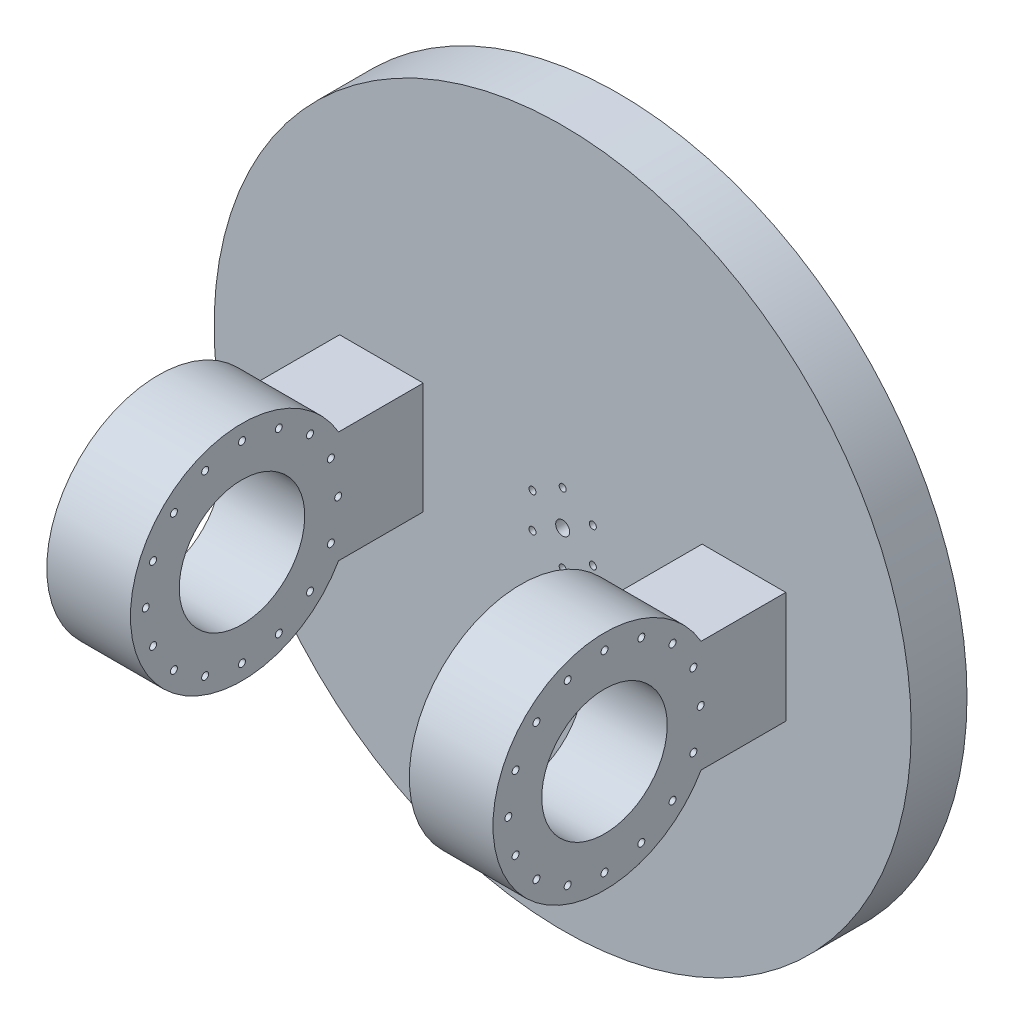
from build123d import *

# Parameters (mm, degrees)
SKETCH_1_R               = 16
EXTRUDE_1_DEPTH          = 10
SKETCH_2_R               = 1.25
EXTRUDE_2_DEPTH          = 10.2
SKETCH_3_R               = 125
EXTRUDE_3_DEPTH          = 20
SKETCH_4_W               = 30
SKETCH_4_H               = 40
EXTRUDE_4_DEPTH          = 41.07
SKETCH_7_R               = 4.1
CUT_EXTRUDE_1_DEPTH      = 4
SKETCH_16_R              = 40
EXTRUDE_10_DEPTH         = 30
EXTRUDE_START            = -30
EXTRUDE_11_DEPTH         = 30
CUT_EXTRUDE_6_DEPTH      = 267.223590239
CUT_EXTRUDE_6_DEPTH_BACK = 267.223590239
SKETCH_18_R              = 1.25
SKETCH_19_R              = 22.5
CUT_EXTRUDE_7_DEPTH      = 180
CUT_EXTRUDE_8_DEPTH      = 217.506350946
CUT_EXTRUDE_8_DEPTH_BACK = 217.506350946
SKETCH_20_R              = 1.25
CUT_EXTRUDE_9_DEPTH      = 206.60885195
CUT_EXTRUDE_9_DEPTH_BACK = 206.60885195
SKETCH_21_R              = 2.5


with BuildPart() as part:
    # 草图1 → 凸台-拉伸1 (new body)
    with BuildSketch(Plane.XY):
        Circle(SKETCH_1_R)
    extrude(amount=EXTRUDE_1_DEPTH)

    # 草图2 → 凸台-拉伸2 (add)
    with BuildSketch(Plane(origin=(0, 0, 0), x_dir=(-1, 0, 0), z_dir=(0, 0, -1))):
        with Locations(Location((0, 12.5, 0), (0, 0, 180))):
            Circle(SKETCH_2_R)
        with Locations(Location((10.825317547, 6.25, 0), (0, 0, 180))):
            Circle(SKETCH_2_R)
        with Locations(Location((10.825317547, -6.25, 0), (0, 0, 180))):
            Circle(SKETCH_2_R)
        with Locations(Location((0, -12.5, 0), (0, 0, 180))):
            Circle(SKETCH_2_R)
        with Locations(Location((-10.825317547, -6.25, 0), (0, 0, 180))):
            Circle(SKETCH_2_R)
        with Locations(Location((-10.825317547, 6.25, 0), (0, 0, 180))):
            Circle(SKETCH_2_R)
    extrude(amount=EXTRUDE_2_DEPTH)

    # 草图3 → 凸台-拉伸3 (add)
    with BuildSketch(Plane.XY.offset(10)):
        Circle(SKETCH_3_R)
    extrude(amount=-EXTRUDE_3_DEPTH)

    # 草图4 → 凸台-拉伸4 (add)
    with BuildSketch(Plane.XY.offset(10)):
        with Locations((65, 0)):
            Rectangle(SKETCH_4_W, SKETCH_4_H)
        with Locations((-65, 0)):
            Rectangle(SKETCH_4_W, SKETCH_4_H)
    extrude(amount=EXTRUDE_4_DEPTH)

    # 草图7 → 切除-拉伸1 (cut)
    with BuildSketch(Plane(origin=(0, 0, 0), x_dir=(-1, 0, 0), z_dir=(0, 0, -1))):
        Circle(SKETCH_7_R)
    extrude(amount=-CUT_EXTRUDE_1_DEPTH, mode=Mode.SUBTRACT)

    # 草图16 → 凸台-拉伸10 (add)
    with BuildSketch(Plane.ZY.offset(80)):
        with Locations((75, 0)):
            Circle(SKETCH_16_R)
    extrude(amount=-EXTRUDE_10_DEPTH)

    # 草图17 → 凸台-拉伸11 (add)
    with BuildSketch(Plane(origin=(80, 0, 0), x_dir=(0, 0, -1), z_dir=(1, 0, 0)).offset(EXTRUDE_START)):
        with BuildLine():
            Line((-40.358983849, 20), (-51.07, 20))
            Line((-51.07, 20), (-51.07, -20))
            Line((-51.07, -20), (-40.358983849, -20))
            ThreePointArc((-40.358983849, -20), (-115, 0), (-40.358983849, 20))
        make_face()
    extrude(amount=EXTRUDE_11_DEPTH)

    # 草图18 → 切除-拉伸6 (cut, two sides: drawn at the far end of the back side and taken through both)
    with BuildSketch(Plane.ZY.offset(80).offset(-CUT_EXTRUDE_6_DEPTH_BACK)):
        with Locations((109.5, 0)):
            Circle(SKETCH_18_R)
        with Locations((106.873843872, -13.202578417)):
            Circle(SKETCH_18_R)
        with Locations((99.395183951, -24.395183951)):
            Circle(SKETCH_18_R)
        with Locations((88.202578417, -31.873843872)):
            Circle(SKETCH_18_R)
        with Locations((75, -34.5)):
            Circle(SKETCH_18_R)
        with Locations((61.797421583, -31.873843872)):
            Circle(SKETCH_18_R)
        with Locations((50.604816049, -24.395183951)):
            Circle(SKETCH_18_R)
        with Locations((43.126156128, -13.202578417)):
            Circle(SKETCH_18_R)
        with Locations((40.5, 0)):
            Circle(SKETCH_18_R)
        with Locations((43.126156128, 13.202578417)):
            Circle(SKETCH_18_R)
        with Locations((50.604816049, 24.395183951)):
            Circle(SKETCH_18_R)
        with Locations((61.797421583, 31.873843872)):
            Circle(SKETCH_18_R)
        with Locations((75, 34.5)):
            Circle(SKETCH_18_R)
        with Locations((88.202578417, 31.873843872)):
            Circle(SKETCH_18_R)
        with Locations((99.395183951, 24.395183951)):
            Circle(SKETCH_18_R)
        with Locations((106.873843872, 13.202578417)):
            Circle(SKETCH_18_R)
    extrude(amount=CUT_EXTRUDE_6_DEPTH + CUT_EXTRUDE_6_DEPTH_BACK, mode=Mode.SUBTRACT)

    # 草图19 → 切除-拉伸7 (cut)
    with BuildSketch(Plane(origin=(80, 0, 0), x_dir=(0, 0, -1), z_dir=(1, 0, 0))):
        with Locations(Location((-75, 0, 0), (0, 0, 90))):
            Circle(SKETCH_19_R)
    extrude(amount=-CUT_EXTRUDE_7_DEPTH, mode=Mode.SUBTRACT)

    # 草图20 → 切除-拉伸8 (cut, two sides: drawn at the far end of the back side and taken through both)
    with BuildSketch(Plane(origin=(0, 0, -10), x_dir=(-1, 0, 0), z_dir=(0, 0, -1)).offset(-CUT_EXTRUDE_8_DEPTH_BACK)):
        with Locations(Location((0, 12.5, 0), (0, 0, 180))):
            Circle(SKETCH_20_R)
        with Locations(Location((10.825317547, 6.25, 0), (0, 0, 180))):
            Circle(SKETCH_20_R)
        with Locations(Location((10.825317547, -6.25, 0), (0, 0, 180))):
            Circle(SKETCH_20_R)
        with Locations(Location((0, -12.5, 0), (0, 0, 180))):
            Circle(SKETCH_20_R)
        with Locations(Location((-10.825317547, -6.25, 0), (0, 0, 180))):
            Circle(SKETCH_20_R)
        with Locations(Location((-10.825317547, 6.25, 0), (0, 0, 180))):
            Circle(SKETCH_20_R)
    extrude(amount=CUT_EXTRUDE_8_DEPTH + CUT_EXTRUDE_8_DEPTH_BACK, mode=Mode.SUBTRACT)

    # 草图21 → 切除-拉伸9 (cut, two sides: drawn at the far end of the back side and taken through both)
    with BuildSketch(Plane.XY.offset(10).offset(-CUT_EXTRUDE_9_DEPTH_BACK)):
        Circle(SKETCH_21_R)
    extrude(amount=CUT_EXTRUDE_9_DEPTH + CUT_EXTRUDE_9_DEPTH_BACK, mode=Mode.SUBTRACT)


solid = part.part
